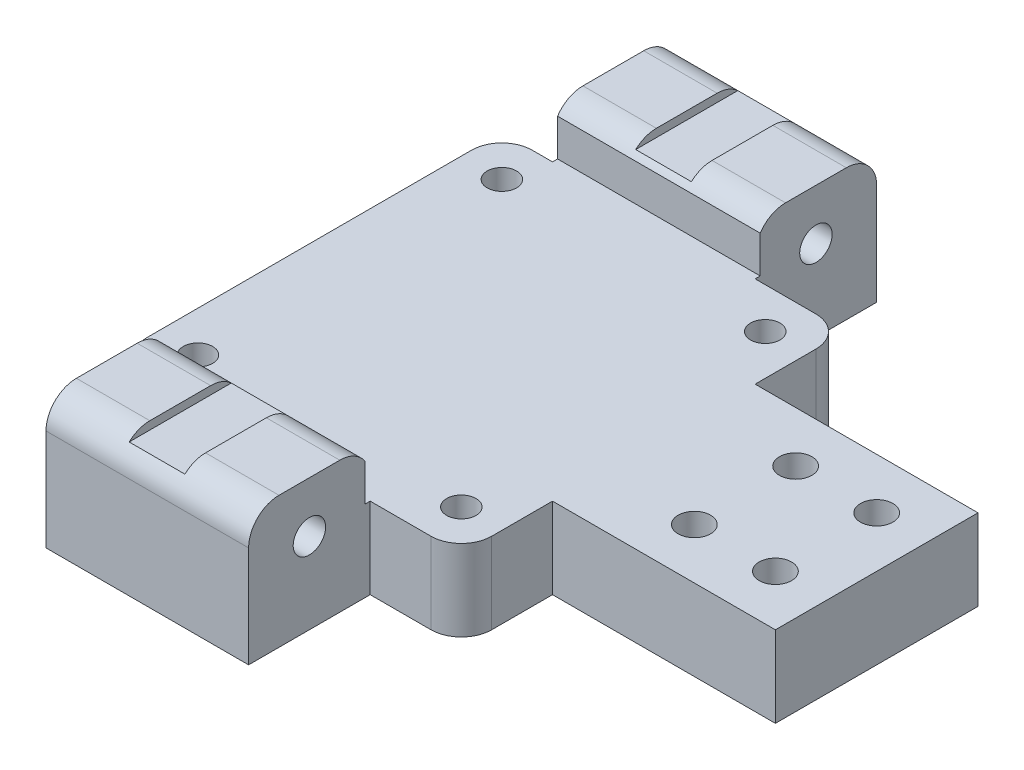
from build123d import *

# Parameters (mm, degrees)
SKETCH1_W            = 300
SKETCH1_H            = 20
BOSS_EXTRUDE1_DEPTH  = 8
SKETCH2_W            = 34
SKETCH2_H            = 8
BOSS_EXTRUDE2_DEPTH  = 9
SKETCH3_W            = 34
SKETCH3_H            = 8
BOSS_EXTRUDE3_DEPTH  = 9
SKETCH4_R            = 1.45
CUT_EXTRUDE1_DEPTH   = 302.504560496
SKETCH5_W            = 25
SKETCH5_H            = 8
BOSS_EXTRUDE4_DEPTH  = 17
SKETCH6_W            = 25
SKETCH6_H            = 8
BOSS_EXTRUDE5_DEPTH  = 17
SKETCH7_W            = 10
SKETCH7_H            = 38
CUT_EXTRUDE2_DEPTH   = 303.37890138
SKETCH8_W            = 7
SKETCH8_H            = 16
CUT_EXTRUDE3_DEPTH   = 4
CUT_EXTRUDE4_DEPTH   = 7
BOSS_EXTRUDE6_DEPTH  = 10
SKETCH12_W           = 8
SKETCH12_H           = 8
BOSS_EXTRUDE7_DEPTH  = 17
SKETCH13_R           = 1.7
CUT_EXTRUDE6_DEPTH   = 305.926220585
SKETCH14_W           = 20
SKETCH14_H           = 13
BOSS_EXTRUDE8_DEPTH  = 12
SKETCH15_R           = 1.6
CUT_EXTRUDE7_DEPTH   = 20
SKETCH16_W           = 20
SKETCH16_H           = 13
BOSS_EXTRUDE9_DEPTH  = 12
SKETCH17_R           = 1.6
CUT_EXTRUDE8_DEPTH   = 20
SKETCH18_W           = 20
SKETCH18_H           = 13
BOSS_EXTRUDE10_DEPTH = 12
CUT_EXTRUDE9_START   = -20
SKETCH19_R           = 1.6
CUT_EXTRUDE9_DEPTH   = 20
SKETCH20_W           = 20
SKETCH20_H           = 13
BOSS_EXTRUDE11_DEPTH = 12
CUT_EXTRUDE10_START  = -20
SKETCH21_R           = 1.6
CUT_EXTRUDE10_DEPTH  = 20
FILLET6_R            = 3
SKETCH22_W           = 123.750788161
SKETCH22_H           = 72.639217631
CUT_EXTRUDE11_DEPTH  = 244
SKETCH23_R           = 1.6
CUT_EXTRUDE12_DEPTH  = 71.611613776
FILLET7_R            = 3
SKETCH24_W           = 5.5
SKETCH24_H           = 78.243551934
CUT_EXTRUDE13_DEPTH  = 0.8
SKETCH25_W           = 20
SKETCH25_H           = 5.75655834
CUT_EXTRUDE14_DEPTH  = 0.5
SKETCH26_W           = 20
SKETCH26_H           = 21.459079842
CUT_EXTRUDE15_DEPTH  = 0.5


with BuildPart() as part:
    # Sketch1 → Boss-Extrude1 (new body)
    with BuildSketch(Plane(origin=(0, 0, 0), x_dir=(1, 0, 0), z_dir=(0, 1, 0))):
        with Locations((150, -10)):
            Rectangle(SKETCH1_W, SKETCH1_H)
    extrude(amount=BOSS_EXTRUDE1_DEPTH)

    # Sketch2 → Boss-Extrude2 (add)
    with BuildSketch(Plane.XY.offset(20)):
        with Locations((17, 4)):
            Rectangle(SKETCH2_W, SKETCH2_H)
        with Locations((283, 4)):
            Rectangle(SKETCH2_W, SKETCH2_H)
    extrude(amount=BOSS_EXTRUDE2_DEPTH)

    # Sketch3 → Boss-Extrude3 (add)
    with BuildSketch(Plane(origin=(0, 0, 0), x_dir=(-1, 0, 0), z_dir=(0, 0, -1))):
        with Locations((-17, 4)):
            Rectangle(SKETCH3_W, SKETCH3_H)
        with Locations((-283, 4)):
            Rectangle(SKETCH3_W, SKETCH3_H)
    extrude(amount=BOSS_EXTRUDE3_DEPTH)

    # Sketch4 → Cut-Extrude1 (cut, through all)
    with BuildSketch(Plane(origin=(0, 8, 0), x_dir=(1, 0, 0), z_dir=(0, 1, 0))):
        with Locations(Location((4, 5, 0), (0, 0, 270))):
            Circle(SKETCH4_R)
        with Locations(Location((30, 5, 0), (0, 0, 270))):
            Circle(SKETCH4_R)
        with Locations(Location((30, -25, 0), (0, 0, 270))):
            Circle(SKETCH4_R)
        with Locations(Location((4, -25, 0), (0, 0, 270))):
            Circle(SKETCH4_R)
        with Locations(Location((296, -25, 0), (0, 0, 270))):
            Circle(SKETCH4_R)
        with Locations(Location((296, 5, 0), (0, 0, 270))):
            Circle(SKETCH4_R)
        with Locations(Location((270, -25, 0), (0, 0, 270))):
            Circle(SKETCH4_R)
        with Locations(Location((270, 5, 0), (0, 0, 270))):
            Circle(SKETCH4_R)
    extrude(amount=-CUT_EXTRUDE1_DEPTH, mode=Mode.SUBTRACT)

    # Sketch5 → Boss-Extrude4 (add)
    with BuildSketch(Plane.XY.offset(20)):
        with Locations((253.5, 4)):
            Rectangle(SKETCH5_W, SKETCH5_H)
    extrude(amount=BOSS_EXTRUDE4_DEPTH)

    # Sketch6 → Boss-Extrude5 (add)
    with BuildSketch(Plane(origin=(0, 0, 0), x_dir=(-1, 0, 0), z_dir=(0, 0, -1))):
        with Locations((-253.5, 4)):
            Rectangle(SKETCH6_W, SKETCH6_H)
    extrude(amount=BOSS_EXTRUDE5_DEPTH)

    # Sketch7 → Cut-Extrude2 (cut, through all)
    with BuildSketch(Plane(origin=(0, 8, 0), x_dir=(1, 0, 0), z_dir=(0, 1, 0))):
        with Locations((254, -10)):
            Rectangle(SKETCH7_W, SKETCH7_H)
    extrude(amount=-CUT_EXTRUDE2_DEPTH, mode=Mode.SUBTRACT)

    # Sketch8 → Cut-Extrude3 (cut)
    with BuildSketch(Plane(origin=(0, 8, 0), x_dir=(1, 0, 0), z_dir=(0, 1, 0))):
        with Locations((262.5, -10)):
            Rectangle(SKETCH8_W, SKETCH8_H)
    extrude(amount=-CUT_EXTRUDE3_DEPTH, mode=Mode.SUBTRACT)

    # Sketch9 → Cut-Extrude4 (cut)
    with BuildSketch(Plane.ZY.offset(-259)):
        Polygon((18, 4), (22, 8), (18, 8), align=None)
        Polygon((2, 4), (-2, 8), (2, 8), align=None)
    extrude(amount=-CUT_EXTRUDE4_DEPTH, mode=Mode.SUBTRACT)

    # Sketch10 → Boss-Extrude6 (add)
    with BuildSketch(Plane.ZY.offset(-259)):
        Polygon((-2, 0), (-9, 8), (-9, 0), align=None)
        Polygon((29, 8), (22, 0), (29, 0), align=None)
    extrude(amount=BOSS_EXTRUDE6_DEPTH)

    # Sketch12 → Boss-Extrude7 (add)
    with BuildSketch(Plane.XY.offset(37)):
        with Locations((245, 4)):
            Rectangle(SKETCH12_W, SKETCH12_H)
    extrude(amount=BOSS_EXTRUDE7_DEPTH)

    # Sketch13 → Cut-Extrude6 (cut, through all)
    with BuildSketch(Plane(origin=(0, 8, 0), x_dir=(1, 0, 0), z_dir=(0, 1, 0))):
        with Locations(Location((245, -50, 0), (0, 0, 270))):
            Circle(SKETCH13_R)
        with Locations(Location((245, -18, 0), (0, 0, 270))):
            Circle(SKETCH13_R)
    extrude(amount=-CUT_EXTRUDE6_DEPTH, mode=Mode.SUBTRACT)

    # Sketch14 → Boss-Extrude8 (add)
    with BuildSketch(Plane.XY.offset(29)):
        with Locations((285, 6.5)):
            Rectangle(SKETCH14_W, SKETCH14_H)
    extrude(amount=BOSS_EXTRUDE8_DEPTH)

    # Sketch15 → Cut-Extrude7 (cut)
    with BuildSketch(Plane(origin=(295, 0, 0), x_dir=(0, 0, -1), z_dir=(1, 0, 0))):
        with Locations((-35, 8)):
            Circle(SKETCH15_R)
    extrude(amount=-CUT_EXTRUDE7_DEPTH, mode=Mode.SUBTRACT)

    # Sketch16 → Boss-Extrude9 (add)
    with BuildSketch(Plane(origin=(0, 0, -9), x_dir=(-1, 0, 0), z_dir=(0, 0, -1))):
        with Locations((-285, 6.5)):
            Rectangle(SKETCH16_W, SKETCH16_H)
    extrude(amount=BOSS_EXTRUDE9_DEPTH)

    # Sketch17 → Cut-Extrude8 (cut)
    with BuildSketch(Plane(origin=(295, 0, 0), x_dir=(0, 0, -1), z_dir=(1, 0, 0))):
        with Locations((15, 8)):
            Circle(SKETCH17_R)
    extrude(amount=-CUT_EXTRUDE8_DEPTH, mode=Mode.SUBTRACT)

    # Sketch18 → Boss-Extrude10 (add)
    with BuildSketch(Plane(origin=(0, 0, -9), x_dir=(-1, 0, 0), z_dir=(0, 0, -1))):
        with Locations((-15, 6.5)):
            Rectangle(SKETCH18_W, SKETCH18_H)
    extrude(amount=BOSS_EXTRUDE10_DEPTH)

    # Sketch19 → Cut-Extrude9 (cut)
    with BuildSketch(Plane.ZY.offset(-5).offset(CUT_EXTRUDE9_START)):
        with Locations(Location((-15, 8, 0), (0, 0, 180))):
            Circle(SKETCH19_R)
    extrude(amount=CUT_EXTRUDE9_DEPTH, mode=Mode.SUBTRACT)

    # Sketch20 → Boss-Extrude11 (add)
    with BuildSketch(Plane.XY.offset(29)):
        with Locations((15, 6.5)):
            Rectangle(SKETCH20_W, SKETCH20_H)
    extrude(amount=BOSS_EXTRUDE11_DEPTH)

    # Sketch21 → Cut-Extrude10 (cut)
    with BuildSketch(Plane.ZY.offset(-5).offset(CUT_EXTRUDE10_START)):
        with Locations(Location((35, 8, 0), (0, 0, 180))):
            Circle(SKETCH21_R)
    extrude(amount=CUT_EXTRUDE10_DEPTH, mode=Mode.SUBTRACT)

    # Fillet6
    fillet6_edges = [part.edges().sort_by_distance(p)[0] for p in [
        (285, 13, 29),
        (285, 13, 41),
        (285, 13, -9),
        (285, 13, -21),
        (15, 13, -9),
        (15, 13, -21),
        (15, 13, 29),
        (15, 13, 41),
    ]]
    fillet(fillet6_edges, radius=FILLET6_R)

    # Sketch22 → Cut-Extrude11 (cut)
    with BuildSketch(Plane(origin=(300, 0, 0), x_dir=(0, 0, -1), z_dir=(1, 0, 0))):
        with Locations((-10.128058827, -1.301866478)):
            Rectangle(SKETCH22_W, SKETCH22_H)
    extrude(amount=-CUT_EXTRUDE11_DEPTH, mode=Mode.SUBTRACT)

    # Sketch23 → Cut-Extrude12 (cut, through all)
    with BuildSketch(Plane(origin=(0, 0, 0), x_dir=(-1, 0, 0), z_dir=(0, -1, 0))):
        with Locations(Location((-51, -5, 0), (0, 0, 90))):
            Circle(SKETCH23_R)
        with Locations(Location((-51, -15, 0), (0, 0, 90))):
            Circle(SKETCH23_R)
        with Locations(Location((-43, -5, 0), (0, 0, 90))):
            Circle(SKETCH23_R)
        with Locations(Location((-43, -15, 0), (0, 0, 90))):
            Circle(SKETCH23_R)
    extrude(amount=-CUT_EXTRUDE12_DEPTH, mode=Mode.SUBTRACT)

    # Fillet7
    fillet7_edges = [part.edges().sort_by_distance(p)[0] for p in [
        (0, 4, 29),
        (34, 4, 29),
        (0, 4, -9),
        (34, 4, -9),
    ]]
    fillet(fillet7_edges, radius=FILLET7_R)

    # Sketch24 → Cut-Extrude13 (cut)
    with BuildSketch(Plane(origin=(0, 13, 0), x_dir=(1, 0, 0), z_dir=(0, 1, 0))):
        with Locations((15, -9.577024089)):
            Rectangle(SKETCH24_W, SKETCH24_H)
    extrude(amount=-CUT_EXTRUDE13_DEPTH, mode=Mode.SUBTRACT)

    # Sketch25 → Cut-Extrude14 (cut)
    with BuildSketch(Plane(origin=(0, 0, 29), x_dir=(-1, 0, 0), z_dir=(0, 0, -1))):
        with Locations((-15, 10.87827917)):
            Rectangle(SKETCH25_W, SKETCH25_H)
    extrude(amount=-CUT_EXTRUDE14_DEPTH, mode=Mode.SUBTRACT)

    # Sketch26 → Cut-Extrude15 (cut)
    with BuildSketch(Plane.XY.offset(-9)):
        with Locations((15, 18.729539921)):
            Rectangle(SKETCH26_W, SKETCH26_H)
    extrude(amount=-CUT_EXTRUDE15_DEPTH, mode=Mode.SUBTRACT)


solid = part.part
